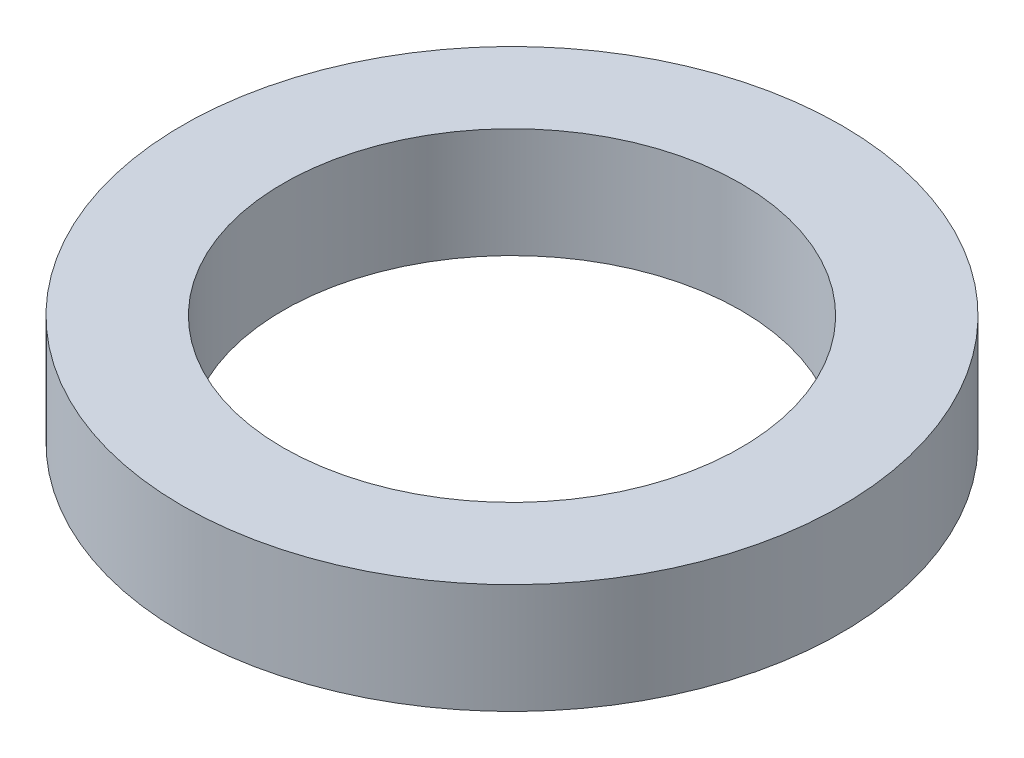
from build123d import *

# Parameters (mm, degrees)
SKETCH1_R           = 9
SKETCH1_R_2         = 6.25
BOSS_EXTRUDE1_DEPTH = 3


with BuildPart() as part:
    # Sketch1 → Boss-Extrude1 (new body)
    with BuildSketch(Plane(origin=(0, 0, 0), x_dir=(1, 0, 0), z_dir=(0, 1, 0))):
        with Locations(Location((0, 0, 0), (0, 0, 270))):
            Circle(SKETCH1_R)
        with Locations(Location((0, 0, 0), (0, 0, 270))):
            Circle(SKETCH1_R_2, mode=Mode.SUBTRACT)
    extrude(amount=BOSS_EXTRUDE1_DEPTH)


solid = part.part
